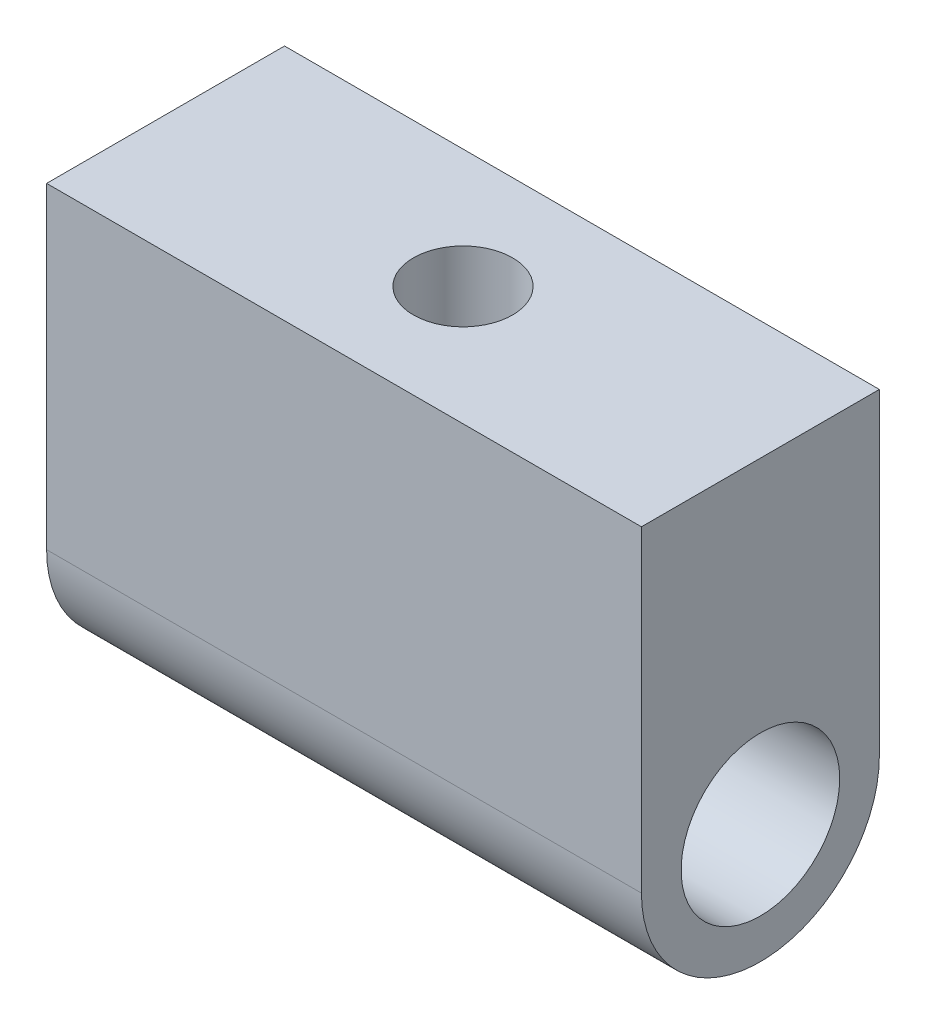
from build123d import *

# Parameters (mm, degrees)
SKETCH1_R           = 4
BOSS_EXTRUDE1_DEPTH = 30
SKETCH2_R           = 2.5
CUT_EXTRUDE1_DEPTH  = 5


with BuildPart() as part:
    # Sketch1 → Boss-Extrude1 (new body)
    with BuildSketch(Plane(origin=(0, 0, 0), x_dir=(0, 0, -1), z_dir=(1, 0, 0))):
        with BuildLine():
            Line((-6, 8), (6, 8))
            Line((6, 8), (6, -8))
            ThreePointArc((6, -8), (0, -14), (-6, -8))
            Line((-6, -8), (-6, 8))
        make_face()
        with Locations((0, -8)):
            Circle(SKETCH1_R, mode=Mode.SUBTRACT)
    extrude(amount=BOSS_EXTRUDE1_DEPTH)

    # Sketch2 → Cut-Extrude1 (cut)
    with BuildSketch(Plane(origin=(0, 8, 0), x_dir=(1, 0, 0), z_dir=(0, 1, 0))):
        with Locations(Location((15, 0, 0), (0, 0, 270))):
            Circle(SKETCH2_R)
    extrude(amount=-CUT_EXTRUDE1_DEPTH, mode=Mode.SUBTRACT)


solid = part.part
